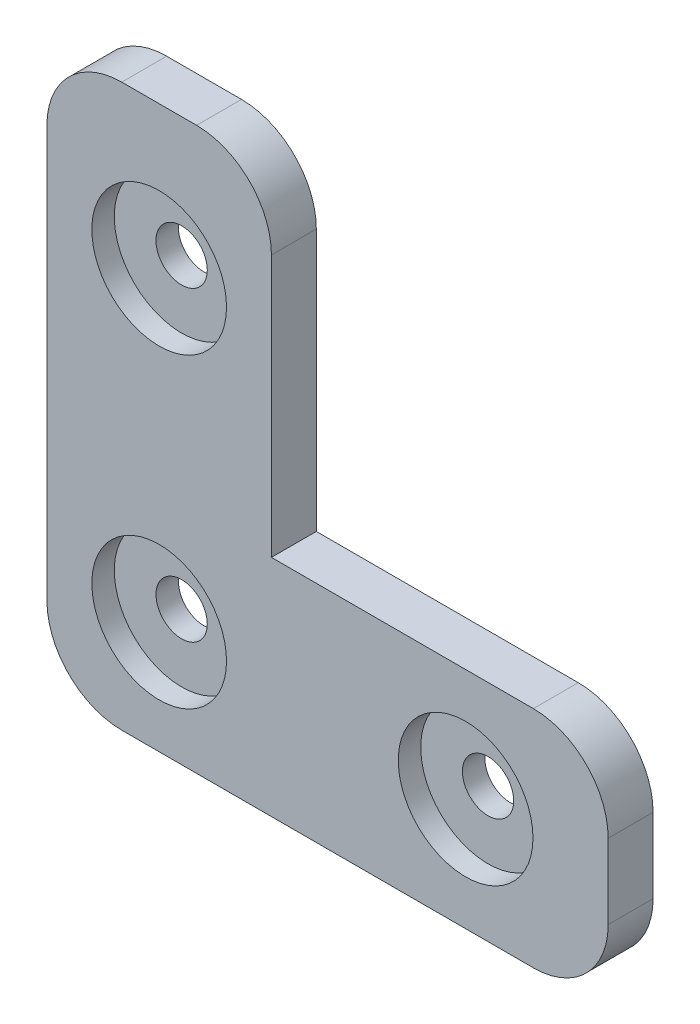
from build123d import *

# Parameters (mm, degrees)
BOSS_EXTRUDE1_DEPTH = 6
SKETCH2_R           = 3.429
CUT_EXTRUDE1_DEPTH  = 107.235587258
SKETCH3_R           = 9
CUT_EXTRUDE2_DEPTH  = 3
FILLET1_R           = 10


with BuildPart() as part:
    # Sketch1 → Boss-Extrude1 (new body)
    with BuildSketch(Plane.XY):
        Polygon((0, 0), (0, 75), (30, 75), (30, 30), (75, 30), (75, 0), align=None)
    extrude(amount=BOSS_EXTRUDE1_DEPTH)

    # Sketch2 → Cut-Extrude1 (cut, through all)
    with BuildSketch(Plane.XY.offset(6)):
        with Locations((15, 15)):
            Circle(SKETCH2_R)
        with Locations((15, 55.95)):
            Circle(SKETCH2_R)
        with Locations((55.95, 15)):
            Circle(SKETCH2_R)
    extrude(amount=-CUT_EXTRUDE1_DEPTH, mode=Mode.SUBTRACT)

    # Sketch3 → Cut-Extrude2 (cut)
    with BuildSketch(Plane.XY.offset(6)):
        with Locations((55.95, 15)):
            Circle(SKETCH3_R)
        with Locations((15, 15)):
            Circle(SKETCH3_R)
        with Locations((15, 55.95)):
            Circle(SKETCH3_R)
    extrude(amount=-CUT_EXTRUDE2_DEPTH, mode=Mode.SUBTRACT)

    # Fillet1
    fillet1_edges = [part.edges().sort_by_distance(p)[0] for p in [
        (0, 0, 3),
        (0, 75, 3),
        (30, 75, 3),
        (75, 30, 3),
        (75, 0, 3),
    ]]
    fillet(fillet1_edges, radius=FILLET1_R)


solid = part.part
